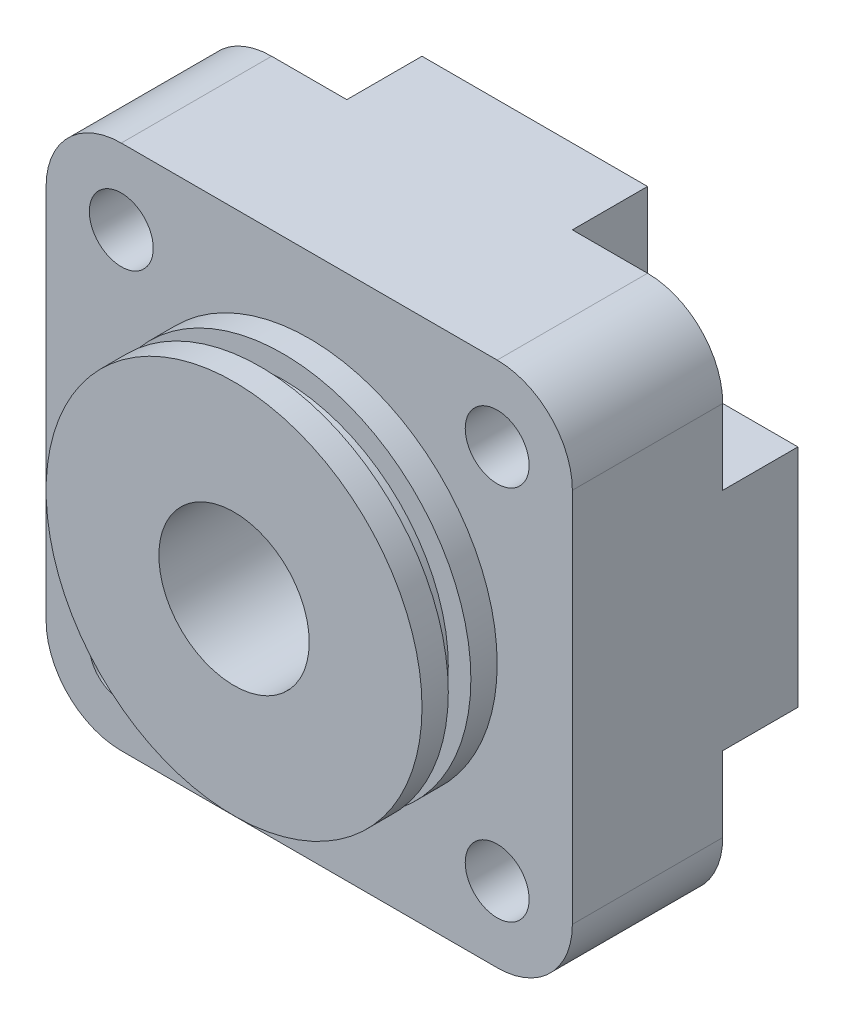
from build123d import *

# Parameters (mm, degrees)
SKETCH1_W               = 70
SKETCH1_H               = 70
BOSS_EXTRUDE1_DEPTH     = 30
SKETCH2_R               = 25
BOSS_EXTRUDE2_DEPTH     = 3.5
SKETCH3_R               = 22
BOSS_EXTRUDE3_DEPTH     = 3
SKETCH4_R               = 25
BOSS_EXTRUDE4_DEPTH     = 3.5
CUT_EXTRUDE1_REACH      = 65.64
SKETCH5_R               = 4.25
SKETCH5_3_W             = 20
SKETCH5_3_H             = 20
SKETCH5_3_R             = 4.25
CUT_EXTRUDE2_DEPTH      = 10
FILLET1_R               = 10
FILLET2_R               = 10
SKETCH7_R               = 10
CUT_EXTRUDE3_DEPTH      = 30
SKETCH8_R               = 9
CUT_EXTRUDE4_DEPTH      = 2
MIRROR6_COPY_1_REACH    = 65.64
MIRROR6_COPY_1_SKETCH_R = 4.25
MIRROR6_COPY_2_SKETCH_W = 20
MIRROR6_COPY_2_SKETCH_H = 20
MIRROR6_COPY_2_SKETCH_R = 4.25
MIRROR6_COPY_2_DEPTH    = 10
FILLET3_R               = 10
M14_TAPPED_HOLE1_D      = 12
M14_TAPPED_HOLE1_DEPTH  = 12
M14_TAPPED_HOLE1_TIP    = 3.605163714
CHAMFER1_SIZE           = 1
CUT_EXTRUDE5_REACH      = 88.308
SKETCH13_R              = 3


with BuildPart() as part:
    # Sketch1 → Boss-Extrude1 (new body)
    with BuildSketch(Plane.XY):
        Rectangle(SKETCH1_W, SKETCH1_H)
    extrude(amount=BOSS_EXTRUDE1_DEPTH)

    # Sketch2 → Boss-Extrude2 (add)
    with BuildSketch(Plane.XY.offset(30)):
        Circle(SKETCH2_R)
    extrude(amount=BOSS_EXTRUDE2_DEPTH)

    # Sketch3 → Boss-Extrude3 (add)
    with BuildSketch(Plane.XY.offset(33.5)):
        Circle(SKETCH3_R)
    extrude(amount=BOSS_EXTRUDE3_DEPTH)

    # Sketch4 → Boss-Extrude4 (add)
    with BuildSketch(Plane.XY.offset(36.5)):
        Circle(SKETCH4_R)
    extrude(amount=BOSS_EXTRUDE4_DEPTH)

    # Sketch5 → Cut-Extrude1 (cut, up to next)
    with BuildSketch(Plane(origin=(0, 0, 0), x_dir=(-1, 0, 0), z_dir=(0, 0, -1)), mode=Mode.PRIVATE) as cut_extrude1_sk1:
        with Locations((-25, 25)):
            Circle(SKETCH5_R)
    cut_extrude1_tool1 = extrude(cut_extrude1_sk1.sketch, amount=-CUT_EXTRUDE1_REACH, mode=Mode.PRIVATE) & part.part
    cut_extrude1 = cut_extrude1_tool1.solids().sort_by_distance((25, 25, 0))[0]
    add(cut_extrude1, mode=Mode.SUBTRACT)

    # Sketch5<3> → Cut-Extrude2 (cut)
    with BuildSketch(Plane(origin=(0, 0, 0), x_dir=(-1, 0, 0), z_dir=(0, 0, -1))):
        with Locations((-25, 25)):
            Rectangle(SKETCH5_3_W, SKETCH5_3_H)
        with Locations((-25, 25)):
            Circle(SKETCH5_3_R, mode=Mode.SUBTRACT)
    cut_extrude2 = extrude(amount=-CUT_EXTRUDE2_DEPTH, mode=Mode.SUBTRACT)

    # Fillet1
    fillet1_edges = [part.edges().sort_by_distance(p)[0] for p in [
        (15, 15, 5),
        (35, 35, 20),
    ]]
    fillet(fillet1_edges, radius=FILLET1_R)

    # Fillet2
    fillet2_edges = [part.edges().sort_by_distance(p)[0] for p in [
        (-35, 35, 15),
        (-35, -35, 15),
        (35, -35, 15),
    ]]
    fillet(fillet2_edges, radius=FILLET2_R)

    # Sketch7 → Cut-Extrude3 (cut)
    with BuildSketch(Plane.XY.offset(40)):
        Circle(SKETCH7_R)
    extrude(amount=-CUT_EXTRUDE3_DEPTH, mode=Mode.SUBTRACT)

    # Sketch8 → Cut-Extrude4 (cut)
    with BuildSketch(Plane.ZY.offset(35)):
        with Locations((15, 0)):
            Circle(SKETCH8_R)
    extrude(amount=-CUT_EXTRUDE4_DEPTH, mode=Mode.SUBTRACT)

    # Mirror5: Cut-Extrude1, Cut-Extrude2 across plane
    add(cut_extrude1.mirror(Plane.ZX), mode=Mode.SUBTRACT)
    add(cut_extrude2.mirror(Plane.ZX), mode=Mode.SUBTRACT)

    # Mirror6: Cut-Extrude1, Cut-Extrude2 across plane
    add(cut_extrude1.mirror(Plane(origin=(0, 0, 0), x_dir=(0, 0, 1), z_dir=(1, 0, 0))), mode=Mode.SUBTRACT)
    add(cut_extrude2.mirror(Plane(origin=(0, 0, 0), x_dir=(0, 0, 1), z_dir=(1, 0, 0))), mode=Mode.SUBTRACT)

    # Mirror6 copy 1 sketch → Mirror6 copy 1 (cut, up to next)
    with BuildSketch(Plane(origin=(0, 0, 0), x_dir=(1, 0, 0), z_dir=(0, 0, -1)), mode=Mode.PRIVATE) as mirror6_copy_1_sk1:
        with Locations((-25, 25)):
            Circle(MIRROR6_COPY_1_SKETCH_R)
    mirror6_copy_1_tool1 = extrude(mirror6_copy_1_sk1.sketch, amount=-MIRROR6_COPY_1_REACH, mode=Mode.PRIVATE) & part.part
    add(mirror6_copy_1_tool1.solids().sort_by_distance((-25, -25, 0))[0], mode=Mode.SUBTRACT)

    # Mirror6 copy 2 sketch → Mirror6 copy 2 (cut)
    with BuildSketch(Plane(origin=(0, 0, 0), x_dir=(1, 0, 0), z_dir=(0, 0, -1))):
        with Locations((-25, 25)):
            Rectangle(MIRROR6_COPY_2_SKETCH_W, MIRROR6_COPY_2_SKETCH_H)
        with Locations((-25, 25)):
            Circle(MIRROR6_COPY_2_SKETCH_R, mode=Mode.SUBTRACT)
    extrude(amount=-MIRROR6_COPY_2_DEPTH, mode=Mode.SUBTRACT)

    # Fillet3
    fillet3_edges = [part.edges().sort_by_distance(p)[0] for p in [
        (-15, 15, 5),
        (-15, -15, 5),
        (15, -15, 5),
    ]]
    fillet(fillet3_edges, radius=FILLET3_R)

    # M14 Tapped Hole1
    with Locations(Plane.ZY.offset(33)):
        with Locations((15, 0)):
            Hole(M14_TAPPED_HOLE1_D / 2, depth=M14_TAPPED_HOLE1_DEPTH)
            with Locations((0, 0, -(M14_TAPPED_HOLE1_DEPTH + M14_TAPPED_HOLE1_TIP / 2))):  # 118° drill point
                Cone(0, M14_TAPPED_HOLE1_D / 2, M14_TAPPED_HOLE1_TIP, mode=Mode.SUBTRACT)

    # Chamfer1
    chamfer1_edges = [part.edges().sort_by_distance(p)[0] for p in [
        (-33, 0, 21),
    ]]
    chamfer(chamfer1_edges, length=CHAMFER1_SIZE)

    # Sketch13 → Cut-Extrude5 (cut, up to next)
    with BuildSketch(Plane.ZY.offset(33), mode=Mode.PRIVATE) as cut_extrude5_sk1:
        with Locations((15, 0)):
            Circle(SKETCH13_R)
    cut_extrude5_tool1 = extrude(cut_extrude5_sk1.sketch, amount=-CUT_EXTRUDE5_REACH, mode=Mode.PRIVATE) & part.part
    add(cut_extrude5_tool1.solids().sort_by_distance((-33, 0, 15))[0], mode=Mode.SUBTRACT)


solid = part.part
